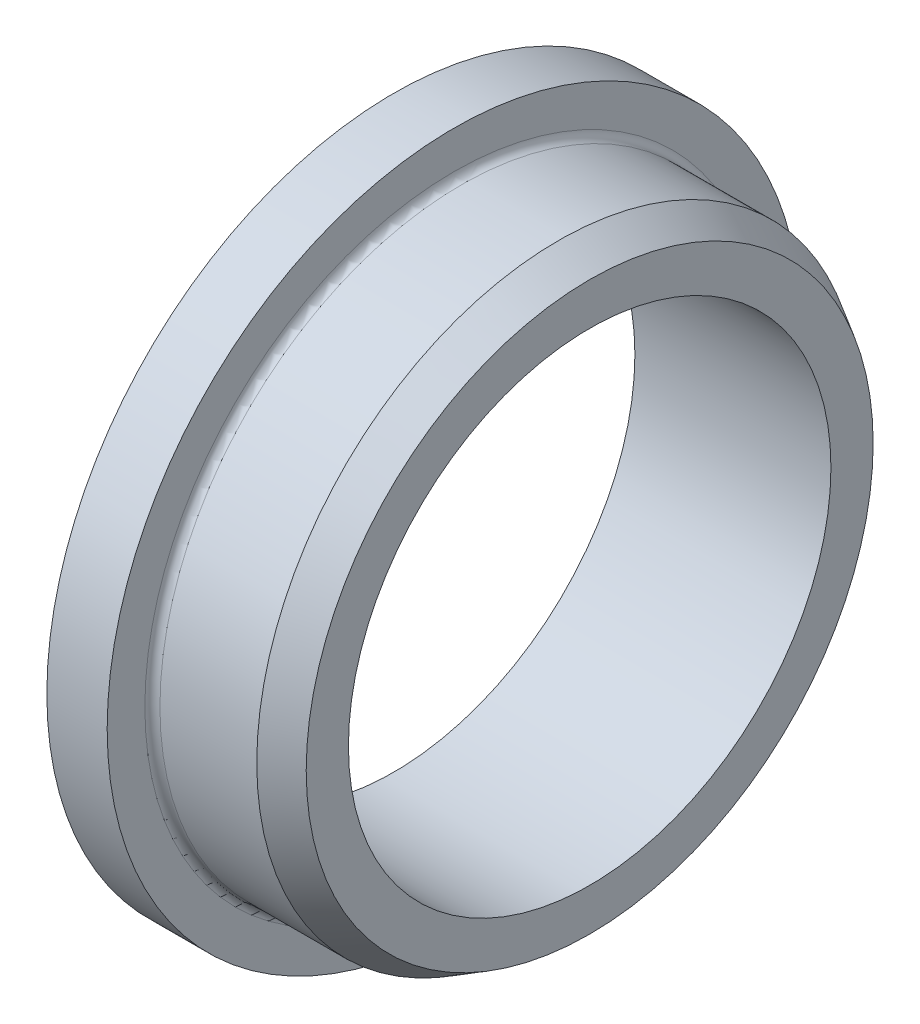
from build123d import *

# Parameters (mm, degrees)
FILLET1_R      = 0.5
CHAMFER1_SIZE  = 1.2
CHAMFER1_SIZE2 = 2.078460969


with BuildPart() as part:
    # Sketch1 → Revolve1 (revolve)
    with BuildSketch(Plane.XY, mode=Mode.PRIVATE) as revolve1_sk:
        Polygon((0, 16), (13, 16), (13, 20), (4, 20), (4, 23), (0, 23), align=None)
    revolve(revolve1_sk.sketch.rotate(Axis((0, 0, 0), (1, 0, 0)), 90), axis=Axis((0, 0, 0), (1, 0, 0)))

    # Fillet1
    fillet1_edges = [part.edges().sort_by_distance(p)[0] for p in [
        (4, 0, -20),
    ]]
    fillet(fillet1_edges, radius=FILLET1_R)

    # Chamfer1
    chamfer1_edges = [part.edges().sort_by_distance(p)[0] for p in [
        (13, 0, -20),
    ]]
    chamfer1_side = [part.faces().sort_by_distance(p)[0] for p in [
        (13, 0, -16.565685425),
    ]]
    chamfer(chamfer1_edges, length=CHAMFER1_SIZE, length2=CHAMFER1_SIZE2, reference=chamfer1_side[0])


solid = part.part
